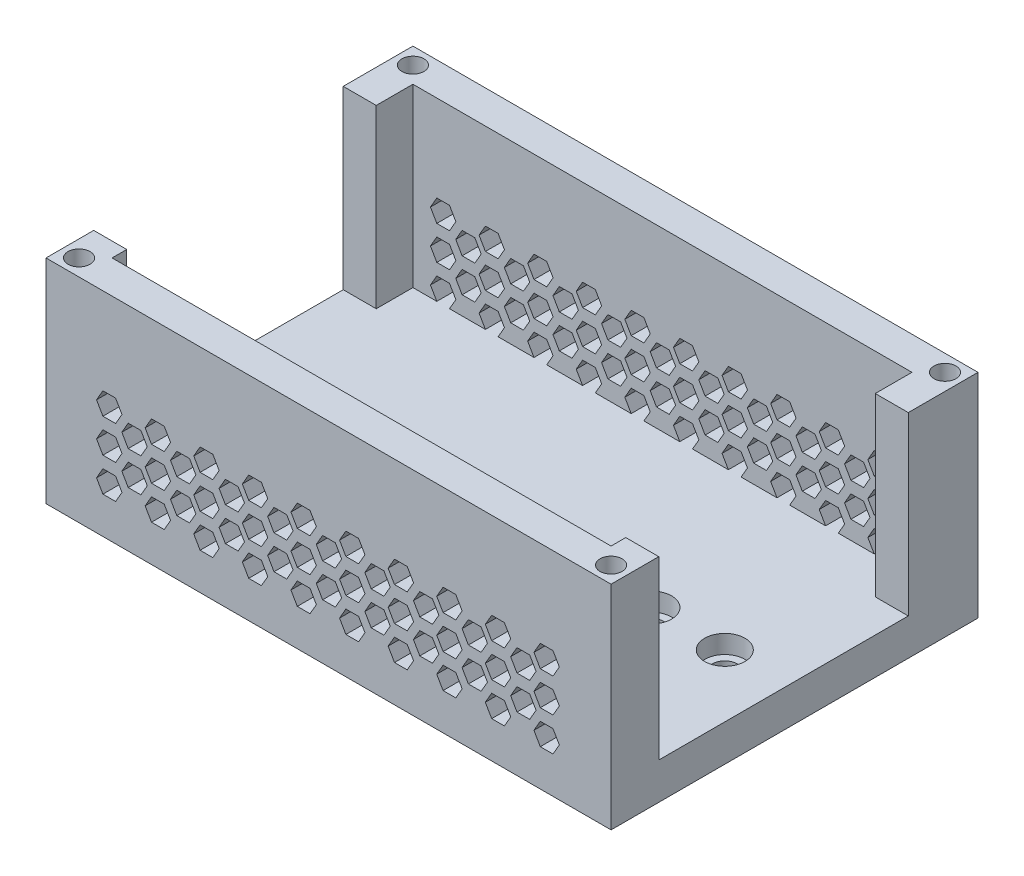
from build123d import *

# Parameters (mm, degrees)
SKETCH1_R             = 1.5
BOSS_EXTRUDE1_DEPTH   = 24
BOSS_EXTRUDE1_2_DEPTH = 24
BOSS_EXTRUDE2_START   = 5
SKETCH2_W             = 77
SKETCH2_H             = 50
SKETCH2_R             = 1.5
SKETCH2_R_2           = 1.7
BOSS_EXTRUDE2_DEPTH   = 5
SKETCH3_R             = 2.75
CUT_EXTRUDE1_DEPTH    = 2.5
CUT_EXTRUDE2_DEPTH    = 92.281159064


with BuildPart() as part:
    # Sketch1 → Boss-Extrude1 (new body)
    with BuildSketch(Plane(origin=(0, 0, 0), x_dir=(1, 0, 0), z_dir=(0, 1, 0))):
        Polygon((-4.5, 45.5), (72.5, 45.5), (72.5, 36), (68, 36), (68, 41), (0, 41), (0, 36), (-4.5, 36), align=None)
        with Locations(Location((-2.25, 43.25, 0), (0, 0, 270))):
            Circle(SKETCH1_R, mode=Mode.SUBTRACT)
        with Locations(Location((70.25, 43.25, 0), (0, 0, 270))):
            Circle(SKETCH1_R, mode=Mode.SUBTRACT)
    extrude(amount=BOSS_EXTRUDE1_DEPTH)



with BuildPart() as body_2:
    # Sketch1 → Boss-Extrude1 2 (new body)
    with BuildSketch(Plane(origin=(0, 0, 0), x_dir=(1, 0, 0), z_dir=(0, 1, 0))):
        Polygon((0, 0), (68, 0), (68, 2), (72.5, 2), (72.5, -4.5), (-4.5, -4.5), (-4.5, 2), (0, 2), align=None)
        with Locations(Location((70.25, -2.25, 0), (0, 0, 270))):
            Circle(SKETCH1_R, mode=Mode.SUBTRACT)
        with Locations(Location((-2.25, -2.25, 0), (0, 0, 270))):
            Circle(SKETCH1_R, mode=Mode.SUBTRACT)
    extrude(amount=BOSS_EXTRUDE1_2_DEPTH)


with BuildPart() as part_1:
    add(part.part)

    add(body_2.part)  # Boss-Extrude2 merges body 2
    # Sketch2 → Boss-Extrude2 (add)
    with BuildSketch(Plane.XZ.offset(BOSS_EXTRUDE2_START)):
        with Locations((34, -20.5)):
            Rectangle(SKETCH2_W, SKETCH2_H)
        with Locations(Location((70.25, 2.25, 0), (0, 0, 270))):
            Circle(SKETCH2_R, mode=Mode.SUBTRACT)
        with Locations(Location((-2.25, -43.25, 0), (0, 0, 90))):
            Circle(SKETCH2_R, mode=Mode.SUBTRACT)
        with Locations(Location((70.25, -43.25, 0), (0, 0, 90))):
            Circle(SKETCH2_R, mode=Mode.SUBTRACT)
        with Locations(Location((4, -19.5, 0), (0, 0, 270))):
            Circle(SKETCH2_R_2, mode=Mode.SUBTRACT)
        with Locations(Location((14, -19.5, 0), (0, 0, 270))):
            Circle(SKETCH2_R_2, mode=Mode.SUBTRACT)
        with Locations(Location((24, -19.5, 0), (0, 0, 270))):
            Circle(SKETCH2_R_2, mode=Mode.SUBTRACT)
        with Locations(Location((34, -19.5, 0), (0, 0, 270))):
            Circle(SKETCH2_R_2, mode=Mode.SUBTRACT)
        with Locations(Location((44, -19.5, 0), (0, 0, 270))):
            Circle(SKETCH2_R_2, mode=Mode.SUBTRACT)
        with Locations(Location((54, -19.5, 0), (0, 0, 270))):
            Circle(SKETCH2_R_2, mode=Mode.SUBTRACT)
        with Locations(Location((64, -19.5, 0), (0, 0, 270))):
            Circle(SKETCH2_R_2, mode=Mode.SUBTRACT)
        with Locations(Location((-2.25, 2.25, 0), (0, 0, 270))):
            Circle(SKETCH2_R, mode=Mode.SUBTRACT)
    extrude(amount=-BOSS_EXTRUDE2_DEPTH)

    # Sketch3 → Cut-Extrude1 (cut)
    with BuildSketch(Plane(origin=(0, 0, 0), x_dir=(1, 0, 0), z_dir=(0, 1, 0))):
        with Locations(Location((4, 19.5, 0), (0, 0, 270))):
            Circle(SKETCH3_R)
        with Locations(Location((14, 19.5, 0), (0, 0, 270))):
            Circle(SKETCH3_R)
        with Locations(Location((24, 19.5, 0), (0, 0, 270))):
            Circle(SKETCH3_R)
        with Locations(Location((34, 19.5, 0), (0, 0, 270))):
            Circle(SKETCH3_R)
        with Locations(Location((44, 19.5, 0), (0, 0, 270))):
            Circle(SKETCH3_R)
        with Locations(Location((54, 19.5, 0), (0, 0, 270))):
            Circle(SKETCH3_R)
        with Locations(Location((64, 19.5, 0), (0, 0, 270))):
            Circle(SKETCH3_R)
    extrude(amount=-CUT_EXTRUDE1_DEPTH, mode=Mode.SUBTRACT)

    # Sketch5 → Cut-Extrude2 (cut, through all)
    with BuildSketch(Plane(origin=(0, 0, -45.5), x_dir=(-1, 0, 0), z_dir=(0, 0, -1))):
        Polygon((-58.813819681, 4.002246416), (-59.679845085, 5.502246416), (-61.411895892, 5.502246416), (-62.277921296, 4.002246416), (-61.411895892, 2.502246416), (-59.679845085, 2.502246416), align=None)
        Polygon((-61.987949192, 1.5), (-62.853974596, 3), (-64.586025404, 3), (-65.452050808, 1.5), (-64.586025404, 0), (-62.853974596, 0), align=None)
        Polygon((-52.191492006, 4.002246416), (-53.057517409, 5.502246416), (-54.789568217, 5.502246416), (-55.655593621, 4.002246416), (-54.789568217, 2.502246416), (-53.057517409, 2.502246416), align=None)
        Polygon((-55.365621517, 1.5), (-56.231646921, 3), (-57.963697728, 3), (-58.829723132, 1.5), (-57.963697728, 0), (-56.231646921, 0), align=None)
        Polygon((-45.56916433, 4.002246416), (-46.435189734, 5.502246416), (-48.167240542, 5.502246416), (-49.033265946, 4.002246416), (-48.167240542, 2.502246416), (-46.435189734, 2.502246416), align=None)
        Polygon((-48.743293842, 1.5), (-49.609319246, 3), (-51.341370053, 3), (-52.207395457, 1.5), (-51.341370053, 0), (-49.609319246, 0), align=None)
        Polygon((-38.946836655, 4.002246416), (-39.812862059, 5.502246416), (-41.544912866, 5.502246416), (-42.41093827, 4.002246416), (-41.544912866, 2.502246416), (-39.812862059, 2.502246416), align=None)
        Polygon((-42.120966167, 1.5), (-42.98699157, 3), (-44.719042378, 3), (-45.585067782, 1.5), (-44.719042378, 0), (-42.98699157, 0), align=None)
        Polygon((-32.32450898, 4.002246416), (-33.190534384, 5.502246416), (-34.922585191, 5.502246416), (-35.788610595, 4.002246416), (-34.922585191, 2.502246416), (-33.190534384, 2.502246416), align=None)
        Polygon((-35.498638491, 1.5), (-36.364663895, 3), (-38.096714703, 3), (-38.962740106, 1.5), (-38.096714703, 0), (-36.364663895, 0), align=None)
        Polygon((-25.702181304, 4.002246416), (-26.568206708, 5.502246416), (-28.300257516, 5.502246416), (-29.16628292, 4.002246416), (-28.300257516, 2.502246416), (-26.568206708, 2.502246416), align=None)
        Polygon((-28.876310816, 1.5), (-29.74233622, 3), (-31.474387027, 3), (-32.340412431, 1.5), (-31.474387027, 0), (-29.74233622, 0), align=None)
        Polygon((-19.079853629, 4.002246416), (-19.945879033, 5.502246416), (-21.67792984, 5.502246416), (-22.543955244, 4.002246416), (-21.67792984, 2.502246416), (-19.945879033, 2.502246416), align=None)
        Polygon((-22.253983141, 1.5), (-23.120008544, 3), (-24.852059352, 3), (-25.718084756, 1.5), (-24.852059352, 0), (-23.120008544, 0), align=None)
        Polygon((-12.457525954, 4.002246416), (-13.323551358, 5.502246416), (-15.055602165, 5.502246416), (-15.921627569, 4.002246416), (-15.055602165, 2.502246416), (-13.323551358, 2.502246416), align=None)
        Polygon((-15.631655465, 1.5), (-16.497680869, 3), (-18.229731677, 3), (-19.09575708, 1.5), (-18.229731677, 0), (-16.497680869, 0), align=None)
        Polygon((-5.835198279, 4.002246416), (-6.701223682, 5.502246416), (-8.43327449, 5.502246416), (-9.299299894, 4.002246416), (-8.43327449, 2.502246416), (-6.701223682, 2.502246416), align=None)
        Polygon((-9.00932779, 1.5), (-9.875353194, 3), (-11.607404001, 3), (-12.473429405, 1.5), (-11.607404001, 0), (-9.875353194, 0), align=None)
        Polygon((-2.387000115, 1.5), (-3.253025518, 3), (-4.985076326, 3), (-5.85110173, 1.5), (-4.985076326, 0), (-3.253025518, 0), align=None)
        Polygon((-58.813819681, 8.602246416), (-59.679845085, 10.102246416), (-61.411895892, 10.102246416), (-62.277921296, 8.602246416), (-61.411895892, 7.102246416), (-59.679845085, 7.102246416), align=None)
        Polygon((-61.987949192, 6.1), (-62.853974596, 7.6), (-64.586025404, 7.6), (-65.452050808, 6.1), (-64.586025404, 4.6), (-62.853974596, 4.6), align=None)
        Polygon((-52.191492006, 8.602246416), (-53.057517409, 10.102246416), (-54.789568217, 10.102246416), (-55.655593621, 8.602246416), (-54.789568217, 7.102246416), (-53.057517409, 7.102246416), align=None)
        Polygon((-55.365621517, 6.1), (-56.231646921, 7.6), (-57.963697728, 7.6), (-58.829723132, 6.1), (-57.963697728, 4.6), (-56.231646921, 4.6), align=None)
        Polygon((-45.56916433, 8.602246416), (-46.435189734, 10.102246416), (-48.167240542, 10.102246416), (-49.033265946, 8.602246416), (-48.167240542, 7.102246416), (-46.435189734, 7.102246416), align=None)
        Polygon((-48.743293842, 6.1), (-49.609319246, 7.6), (-51.341370053, 7.6), (-52.207395457, 6.1), (-51.341370053, 4.6), (-49.609319246, 4.6), align=None)
        Polygon((-38.946836655, 8.602246416), (-39.812862059, 10.102246416), (-41.544912866, 10.102246416), (-42.41093827, 8.602246416), (-41.544912866, 7.102246416), (-39.812862059, 7.102246416), align=None)
        Polygon((-42.120966167, 6.1), (-42.98699157, 7.6), (-44.719042378, 7.6), (-45.585067782, 6.1), (-44.719042378, 4.6), (-42.98699157, 4.6), align=None)
        Polygon((-32.32450898, 8.602246416), (-33.190534384, 10.102246416), (-34.922585191, 10.102246416), (-35.788610595, 8.602246416), (-34.922585191, 7.102246416), (-33.190534384, 7.102246416), align=None)
        Polygon((-35.498638491, 6.1), (-36.364663895, 7.6), (-38.096714703, 7.6), (-38.962740106, 6.1), (-38.096714703, 4.6), (-36.364663895, 4.6), align=None)
        Polygon((-25.702181304, 8.602246416), (-26.568206708, 10.102246416), (-28.300257516, 10.102246416), (-29.16628292, 8.602246416), (-28.300257516, 7.102246416), (-26.568206708, 7.102246416), align=None)
        Polygon((-28.876310816, 6.1), (-29.74233622, 7.6), (-31.474387027, 7.6), (-32.340412431, 6.1), (-31.474387027, 4.6), (-29.74233622, 4.6), align=None)
        Polygon((-19.079853629, 8.602246416), (-19.945879033, 10.102246416), (-21.67792984, 10.102246416), (-22.543955244, 8.602246416), (-21.67792984, 7.102246416), (-19.945879033, 7.102246416), align=None)
        Polygon((-22.253983141, 6.1), (-23.120008544, 7.6), (-24.852059352, 7.6), (-25.718084756, 6.1), (-24.852059352, 4.6), (-23.120008544, 4.6), align=None)
        Polygon((-12.457525954, 8.602246416), (-13.323551358, 10.102246416), (-15.055602165, 10.102246416), (-15.921627569, 8.602246416), (-15.055602165, 7.102246416), (-13.323551358, 7.102246416), align=None)
        Polygon((-15.631655465, 6.1), (-16.497680869, 7.6), (-18.229731677, 7.6), (-19.09575708, 6.1), (-18.229731677, 4.6), (-16.497680869, 4.6), align=None)
        Polygon((-5.835198279, 8.602246416), (-6.701223682, 10.102246416), (-8.43327449, 10.102246416), (-9.299299894, 8.602246416), (-8.43327449, 7.102246416), (-6.701223682, 7.102246416), align=None)
        Polygon((-9.00932779, 6.1), (-9.875353194, 7.6), (-11.607404001, 7.6), (-12.473429405, 6.1), (-11.607404001, 4.6), (-9.875353194, 4.6), align=None)
        Polygon((-2.387000115, 6.1), (-3.253025518, 7.6), (-4.985076326, 7.6), (-5.85110173, 6.1), (-4.985076326, 4.6), (-3.253025518, 4.6), align=None)
        Polygon((-61.987949192, 10.7), (-62.853974596, 12.2), (-64.586025404, 12.2), (-65.452050808, 10.7), (-64.586025404, 9.2), (-62.853974596, 9.2), align=None)
        Polygon((-55.365621517, 10.7), (-56.231646921, 12.2), (-57.963697728, 12.2), (-58.829723132, 10.7), (-57.963697728, 9.2), (-56.231646921, 9.2), align=None)
        Polygon((-48.743293842, 10.7), (-49.609319246, 12.2), (-51.341370053, 12.2), (-52.207395457, 10.7), (-51.341370053, 9.2), (-49.609319246, 9.2), align=None)
        Polygon((-42.120966167, 10.7), (-42.98699157, 12.2), (-44.719042378, 12.2), (-45.585067782, 10.7), (-44.719042378, 9.2), (-42.98699157, 9.2), align=None)
        Polygon((-35.498638491, 10.7), (-36.364663895, 12.2), (-38.096714703, 12.2), (-38.962740106, 10.7), (-38.096714703, 9.2), (-36.364663895, 9.2), align=None)
        Polygon((-28.876310816, 10.7), (-29.74233622, 12.2), (-31.474387027, 12.2), (-32.340412431, 10.7), (-31.474387027, 9.2), (-29.74233622, 9.2), align=None)
        Polygon((-22.253983141, 10.7), (-23.120008544, 12.2), (-24.852059352, 12.2), (-25.718084756, 10.7), (-24.852059352, 9.2), (-23.120008544, 9.2), align=None)
        Polygon((-15.631655465, 10.7), (-16.497680869, 12.2), (-18.229731677, 12.2), (-19.09575708, 10.7), (-18.229731677, 9.2), (-16.497680869, 9.2), align=None)
        Polygon((-9.00932779, 10.7), (-9.875353194, 12.2), (-11.607404001, 12.2), (-12.473429405, 10.7), (-11.607404001, 9.2), (-9.875353194, 9.2), align=None)
        Polygon((-2.387000115, 10.7), (-3.253025518, 12.2), (-4.985076326, 12.2), (-5.85110173, 10.7), (-4.985076326, 9.2), (-3.253025518, 9.2), align=None)
    extrude(amount=-CUT_EXTRUDE2_DEPTH, mode=Mode.SUBTRACT)


solid = part_1.part
